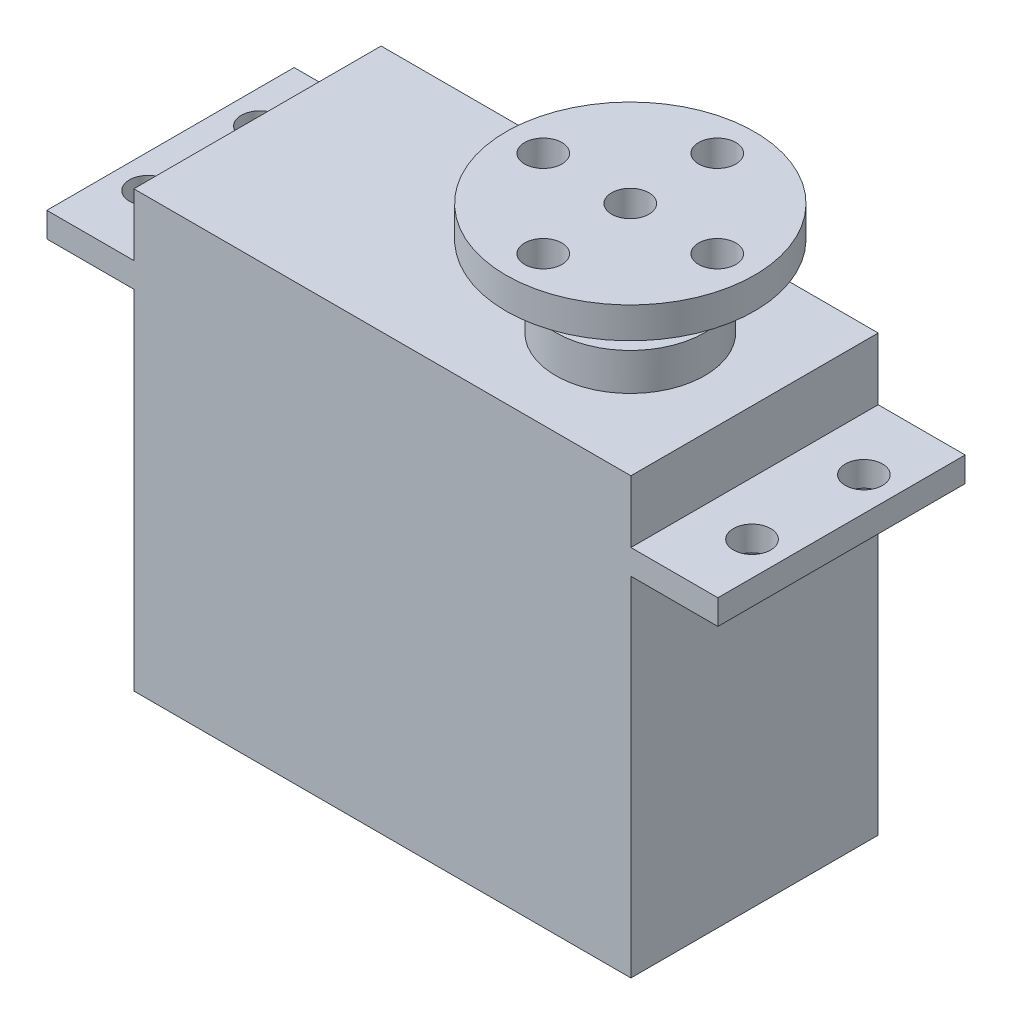
from build123d import *

# Parameters (mm, degrees)
SKETCH_1_W          = 40
SKETCH_1_H          = 19.9
EXTRUDE_1_DEPTH     = 28
SKETCH_2_W          = 54
SKETCH_2_H          = 19.9
EXTRUDE_2_DEPTH     = 2
SKETCH_3_W          = 40
SKETCH_3_H          = 19.9
EXTRUDE_3_DEPTH     = 5
SKETCH_4_R          = 1.5
CUT_EXTRUDE_1_DEPTH = 42.569249452
SKETCH_5_R          = 3
EXTRUDE_4_DEPTH     = 6.5
SKETCH_7_R          = 6
EXTRUDE_5_DEPTH     = 3
SKETCH_8_R          = 4.5
EXTRUDE_6_DEPTH     = 2
SKETCH_9_R          = 10
EXTRUDE_7_DEPTH     = 2.5
SKETCH_10_R         = 1.5
CUT_EXTRUDE_2_DEPTH = 2.5
SKETCH_11_R         = 1.5
CUT_EXTRUDE_3_DEPTH = 6


with BuildPart() as part:
    # 草图1 → 凸台-拉伸1 (new body)
    with BuildSketch(Plane(origin=(0, 0, 0), x_dir=(1, 0, 0), z_dir=(0, 1, 0))):
        Rectangle(SKETCH_1_W, SKETCH_1_H)
    extrude(amount=EXTRUDE_1_DEPTH)

    # 草图2 → 凸台-拉伸2 (add)
    with BuildSketch(Plane(origin=(0, 28, 0), x_dir=(1, 0, 0), z_dir=(0, 1, 0))):
        Rectangle(SKETCH_2_W, SKETCH_2_H)
    extrude(amount=EXTRUDE_2_DEPTH)

    # 草图3 → 凸台-拉伸3 (add)
    with BuildSketch(Plane(origin=(0, 30, 0), x_dir=(1, 0, 0), z_dir=(0, 1, 0))):
        Rectangle(SKETCH_3_W, SKETCH_3_H)
    extrude(amount=EXTRUDE_3_DEPTH)

    # 草图4 → 切除-拉伸1 (cut, through all)
    with BuildSketch(Plane(origin=(0, 30, 0), x_dir=(1, 0, 0), z_dir=(0, 1, 0))):
        with Locations(Location((-24.3, 4.5, 0), (0, 0, 270))):
            Circle(SKETCH_4_R)
        with Locations(Location((24.3, 4.5, 0), (0, 0, 270))):
            Circle(SKETCH_4_R)
        with Locations(Location((24.3, -4.5, 0), (0, 0, 270))):
            Circle(SKETCH_4_R)
        with Locations(Location((-24.3, -4.5, 0), (0, 0, 270))):
            Circle(SKETCH_4_R)
    extrude(amount=-CUT_EXTRUDE_1_DEPTH, mode=Mode.SUBTRACT)

    # 草图5 → 凸台-拉伸4 (add)
    with BuildSketch(Plane(origin=(0, 35, 0), x_dir=(1, 0, 0), z_dir=(0, 1, 0))):
        with Locations(Location((10, 0, 0), (0, 0, 90))):
            Circle(SKETCH_5_R)
    extrude(amount=EXTRUDE_4_DEPTH)

    # 草图7 → 凸台-拉伸5 (add)
    with BuildSketch(Plane(origin=(0, 35, 0), x_dir=(1, 0, 0), z_dir=(0, 1, 0))):
        with Locations(Location((10, 0, 0), (0, 0, 90))):
            Circle(SKETCH_7_R)
    extrude(amount=EXTRUDE_5_DEPTH)

    # 草图8 → 凸台-拉伸6 (add)
    with BuildSketch(Plane(origin=(0, 41.5, 0), x_dir=(1, 0, 0), z_dir=(0, 1, 0))):
        with Locations(Location((10, 0, 0), (0, 0, 270))):
            Circle(SKETCH_8_R)
    extrude(amount=-EXTRUDE_6_DEPTH)

    # 草图9 → 凸台-拉伸7 (add)
    with BuildSketch(Plane(origin=(0, 41.5, 0), x_dir=(1, 0, 0), z_dir=(0, 1, 0))):
        with Locations(Location((10, 0, 0), (0, 0, 270))):
            Circle(SKETCH_9_R)
    extrude(amount=EXTRUDE_7_DEPTH)

    # 草图10 → 切除-拉伸2 (cut)
    with BuildSketch(Plane(origin=(0, 44, 0), x_dir=(1, 0, 0), z_dir=(0, 1, 0))):
        with Locations(Location((10, 7, 0), (0, 0, 270))):
            Circle(SKETCH_10_R)
        with Locations(Location((17, 0, 0), (0, 0, 270))):
            Circle(SKETCH_10_R)
        with Locations(Location((10, -7, 0), (0, 0, 270))):
            Circle(SKETCH_10_R)
        with Locations(Location((3, 0, 0), (0, 0, 270))):
            Circle(SKETCH_10_R)
    extrude(amount=-CUT_EXTRUDE_2_DEPTH, mode=Mode.SUBTRACT)

    # 草图11 → 切除-拉伸3 (cut)
    with BuildSketch(Plane(origin=(0, 44, 0), x_dir=(1, 0, 0), z_dir=(0, 1, 0))):
        with Locations(Location((10, 0, 0), (0, 0, 270))):
            Circle(SKETCH_11_R)
    extrude(amount=-CUT_EXTRUDE_3_DEPTH, mode=Mode.SUBTRACT)


solid = part.part
